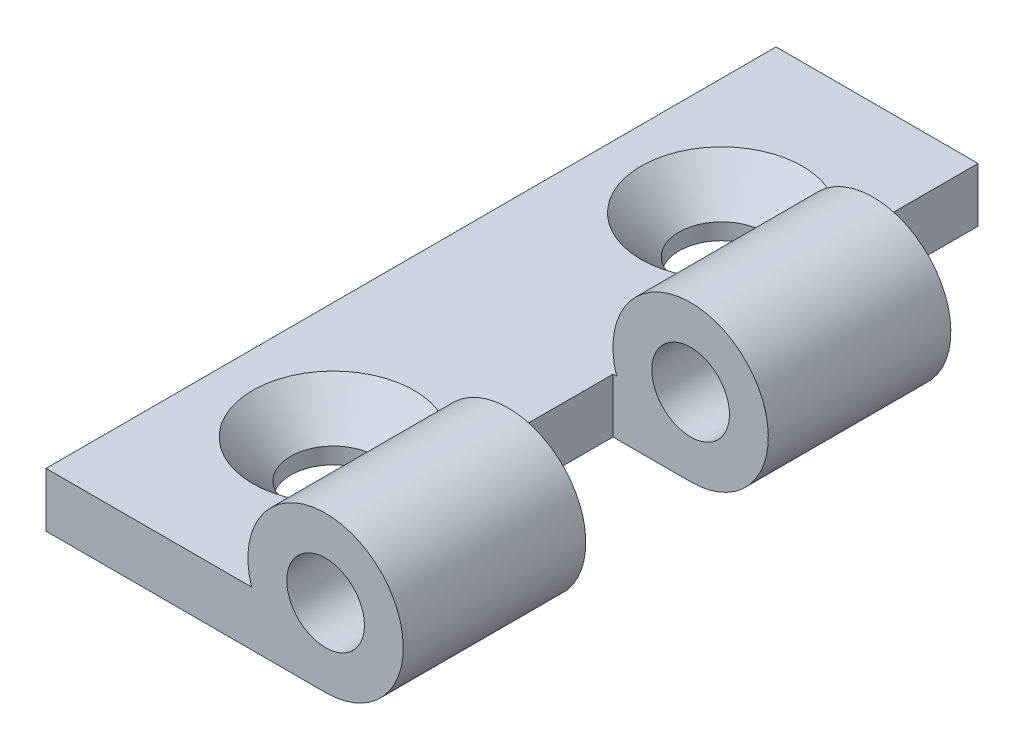
from build123d import *

# Parameters (mm, degrees)
SKETCH1_R                                    = 5
SKETCH1_R_2                                  = 2.5
BOSS_EXTRUDE1_DEPTH                          = 23.5
CSK_FOR_M5_COUNTERSUNK_FLAT_HEAD_SCR_2_COUNT = 2
CSK_FOR_M5_COUNTERSUNK_FLAT_HEAD_SCR_2_PITCH = 25
CUT_EXTRUDE1_DEPTH                           = 31.020826105
CUT_EXTRUDE1_DEPTH_BACK                      = 31.020826105
SKETCH4_W                                    = 10
SKETCH4_H                                    = 11.75


with BuildPart() as part:
    # Sketch1 → Boss-Extrude1 (new, symmetric)
    # profile 1 of 2: a face of its own
    with BuildSketch(Plane.XY):
        with BuildLine():
            Line((-18, -5), (0, -5))
            ThreePointArc((0, -5), (-2.958039892, -4.031128874), (-4.769696007, -1.5))
            Line((-4.769696007, -1.5), (-18, -1.5))
            Line((-18, -1.5), (-18, -5))
        make_face()
    # profile 2 of 2: a face of its own
    with BuildSketch(Plane.XY):
        Circle(SKETCH1_R)
        Circle(SKETCH1_R_2, mode=Mode.SUBTRACT)
    extrude(amount=BOSS_EXTRUDE1_DEPTH, both=True)

    # Sketch3 → CSK for M5 Countersunk Flat Head Screw1 (revolve, cut)
    with BuildSketch(Plane(origin=(-10.5, -1.5, -12.5), x_dir=(0, 0, 1), z_dir=(1, 0, 0))):
        Polygon((0, 0), (0, 3.5), (2.75, 3.5), (2.75, 2.45), (5.2, 0), align=None)
    csk_for_m5_countersunk_flat_head_screw1 = revolve(axis=Axis((-10.5, 4.85, -12.5), (0, -1, 0)), mode=Mode.SUBTRACT)

    # CSK for M5 Countersunk Flat Head Scr 2: CSK for M5 Countersunk Flat Head Screw1 ×2
    with Locations(*[(0, 0, i * CSK_FOR_M5_COUNTERSUNK_FLAT_HEAD_SCR_2_PITCH) for i in range(1, CSK_FOR_M5_COUNTERSUNK_FLAT_HEAD_SCR_2_COUNT)]):
        add(csk_for_m5_countersunk_flat_head_screw1, mode=Mode.SUBTRACT)

    # Sketch4 → Cut-Extrude1 (cut, two sides: drawn at the far end of the back side and taken through both)
    with BuildSketch(Plane(origin=(0, 0, 0), x_dir=(1, 0, 0), z_dir=(0, 1, 0)).offset(-CUT_EXTRUDE1_DEPTH_BACK)):
        with Locations((0, 17.625)):
            Rectangle(SKETCH4_W, SKETCH4_H)
        with Locations((0, -5.875)):
            Rectangle(SKETCH4_W, SKETCH4_H)
    extrude(amount=CUT_EXTRUDE1_DEPTH + CUT_EXTRUDE1_DEPTH_BACK, mode=Mode.SUBTRACT)


solid = part.part
